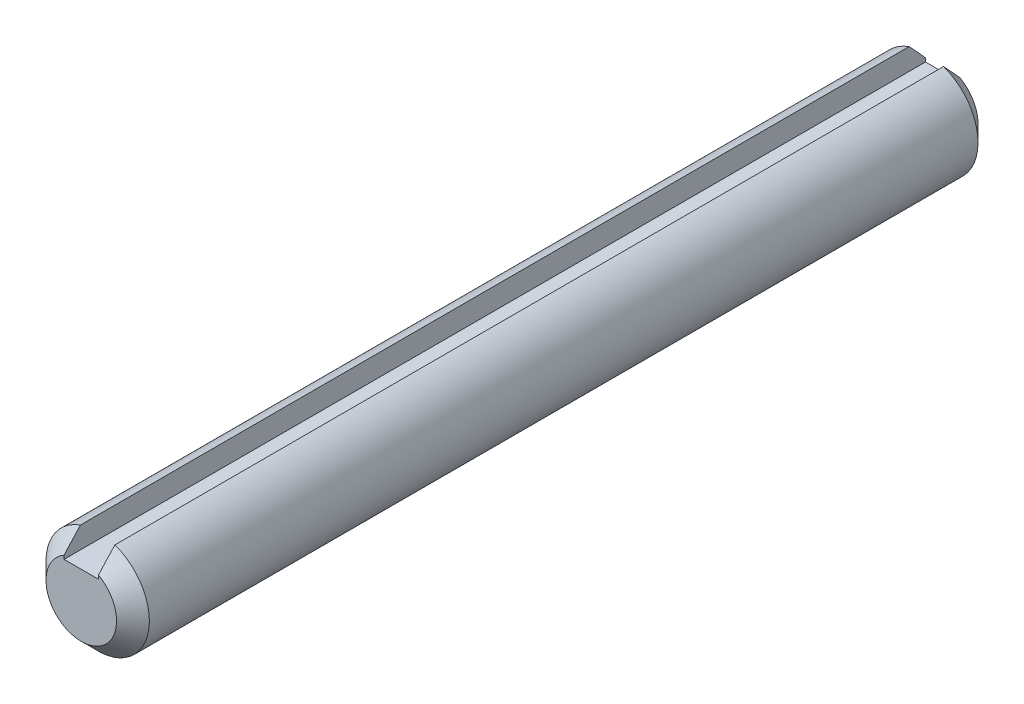
from build123d import *

# Parameters (mm, degrees)
BOSS_EXTRUDE1_DEPTH = 100
CHAMFER1_SIZE       = 1.905


with BuildPart() as part:
    # Sketch3 → Boss-Extrude1 (new body)
    with BuildSketch(Plane.XY):
        with BuildLine():
            Line((-2, 3.156854249), (-2, 5.656854249))
            ThreePointArc((-2, 5.656854249), (0, -6), (2, 5.656854249))
            Line((2, 5.656854249), (2, 3.156854249))
            Line((2, 3.156854249), (-2, 3.156854249))
        make_face()
    extrude(amount=BOSS_EXTRUDE1_DEPTH)

    # Chamfer1
    chamfer1_edges = [part.edges().sort_by_distance(p)[0] for p in [
        (0, -6, 100),
        (0, -6, 0),
    ]]
    chamfer(chamfer1_edges, length=CHAMFER1_SIZE)


solid = part.part
